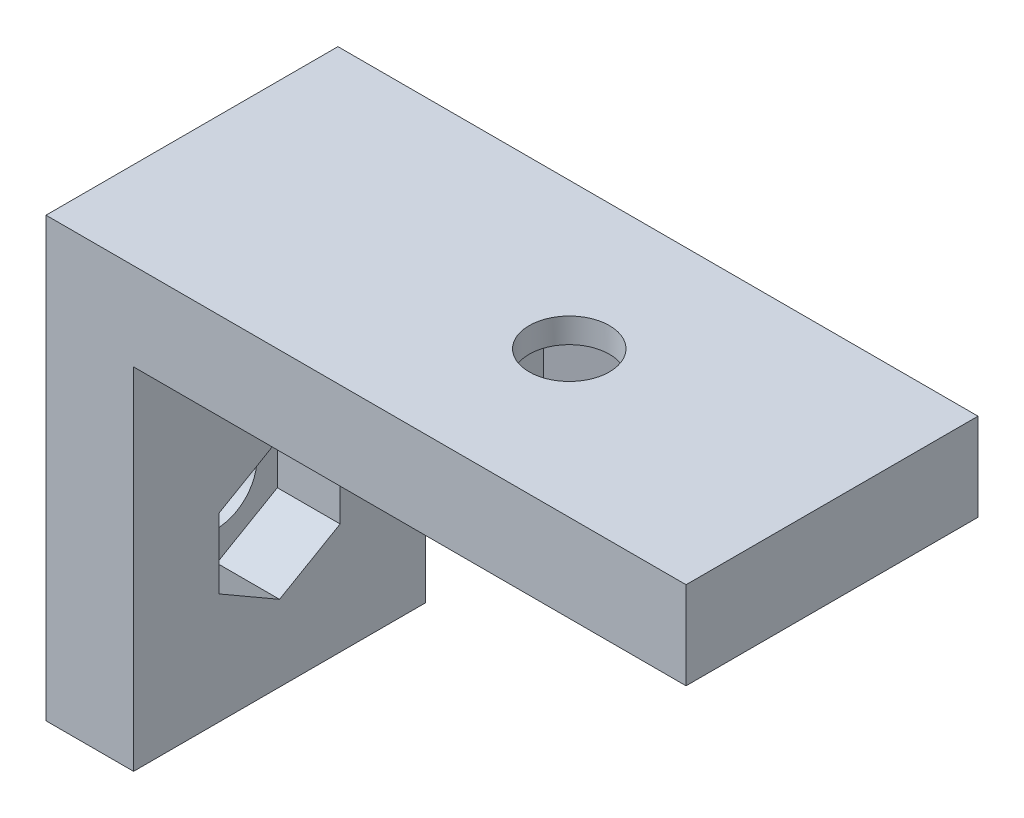
from build123d import *

# Parameters (mm, degrees)
EXTRUDE_20_DEPTH           = 20
CUT_EXTRUDE_5_DEPTH        = 62.64414003
CUT_EXTRUDE_5_DEPTH_BACK   = 62.64414003
SKETCH_5_R                 = 2.75
CUT_EXTRUDE_5_4_3_DEPTH    = 4.3
CUT_EXTRUDE_5_2_DEPTH      = 62.64414003
CUT_EXTRUDE_5_2_DEPTH_BACK = 62.64414003
SKETCH_5_3_R               = 2.75
CUT_EXTRUDE_5_4_3_2_DEPTH  = 4.3


with BuildPart() as part:
    # Профиль_скобы_6мм → Печатный_корпус_20мм (new body)
    with BuildSketch(Plane.XY):
        Polygon((6.15, -30), (12.15, -30), (12.15, -6), (50, -6), (50, 0), (6.15, 0), align=None)
    extrude(amount=EXTRUDE_20_DEPTH)

    # Sketch 5 → Cut-Extrude 5 (cut, two sides: drawn at the far end of the back side and taken through both)
    with BuildSketch(Plane(origin=(0, 0, 0), x_dir=(1, 0, 0), z_dir=(0, 1, 0)).offset(-CUT_EXTRUDE_5_DEPTH_BACK)):
        with Locations(Location((32, -10, 0), (0, 0, 270))):
            Circle(SKETCH_5_R)
    extrude(amount=CUT_EXTRUDE_5_DEPTH + CUT_EXTRUDE_5_DEPTH_BACK, mode=Mode.SUBTRACT)

    # Sketch 5 2 → Cut-Extrude 5_4_3 (cut)
    with BuildSketch(Plane.XZ.offset(6)):
        Polygon((32, 14.792007234), (36.15, 12.396003617), (36.15, 7.603996383), (32, 5.207992766), (27.85, 7.603996383), (27.85, 12.396003617), align=None)
    extrude(amount=-CUT_EXTRUDE_5_4_3_DEPTH, mode=Mode.SUBTRACT)

    # Sketch 5 3 → Cut-Extrude 5 2 (cut, two sides: drawn at the far end of the back side and taken through both)
    with BuildSketch(Plane(origin=(0, 0, 0), x_dir=(0, 0, -1), z_dir=(1, 0, 0)).offset(-CUT_EXTRUDE_5_2_DEPTH_BACK)):
        with Locations(Location((-10, -20, 0), (0, 0, 180))):
            Circle(SKETCH_5_3_R)
    extrude(amount=CUT_EXTRUDE_5_2_DEPTH + CUT_EXTRUDE_5_2_DEPTH_BACK, mode=Mode.SUBTRACT)

    # Sketch 5 4 → Cut-Extrude 5_4_3 2 (cut)
    with BuildSketch(Plane(origin=(12.15, 0, 0), x_dir=(0, 0, -1), z_dir=(1, 0, 0))):
        Polygon((-10, -15.207992766), (-14.15, -17.603996383), (-14.15, -22.396003617), (-10, -24.792007234), (-5.85, -22.396003617), (-5.85, -17.603996383), align=None)
    extrude(amount=-CUT_EXTRUDE_5_4_3_2_DEPTH, mode=Mode.SUBTRACT)


solid = part.part
